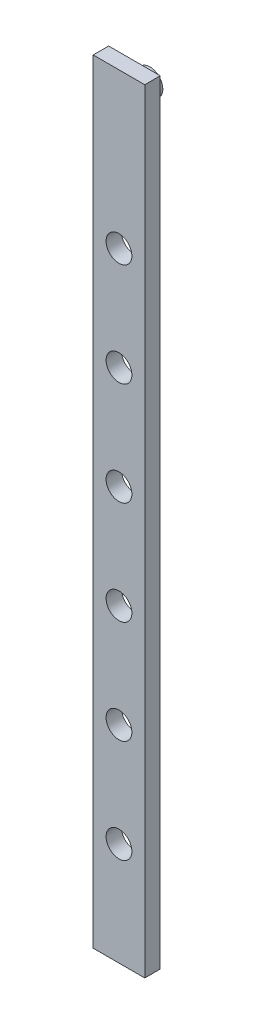
from build123d import *

# Parameters (mm, degrees)
SKETCH_1_W      = 10
SKETCH_1_H      = 150
SKETCH_1_R      = 2.5
EXTRUDE_1_DEPTH = 3
SKETCH_2_R      = 2.5
EXTRUDE_2_DEPTH = 6


with BuildPart() as part:
    # 草圖1 → 填料-伸長1 (new body)
    with BuildSketch(Plane.XY):
        Rectangle(SKETCH_1_W, SKETCH_1_H)
        with Locations((0, -55)):
            Circle(SKETCH_1_R, mode=Mode.SUBTRACT)
        with Locations((0, -35)):
            Circle(SKETCH_1_R, mode=Mode.SUBTRACT)
        with Locations((0, -15)):
            Circle(SKETCH_1_R, mode=Mode.SUBTRACT)
        with Locations((0, 5)):
            Circle(SKETCH_1_R, mode=Mode.SUBTRACT)
        with Locations((0, 25)):
            Circle(SKETCH_1_R, mode=Mode.SUBTRACT)
        with Locations((0, 45)):
            Circle(SKETCH_1_R, mode=Mode.SUBTRACT)
    extrude(amount=EXTRUDE_1_DEPTH)

    # 草圖2 → 填料-伸長2 (add)
    with BuildSketch(Plane.XY.offset(3)):
        with Locations((0, 70)):
            Circle(SKETCH_2_R)
    extrude(amount=-EXTRUDE_2_DEPTH)


solid = part.part
